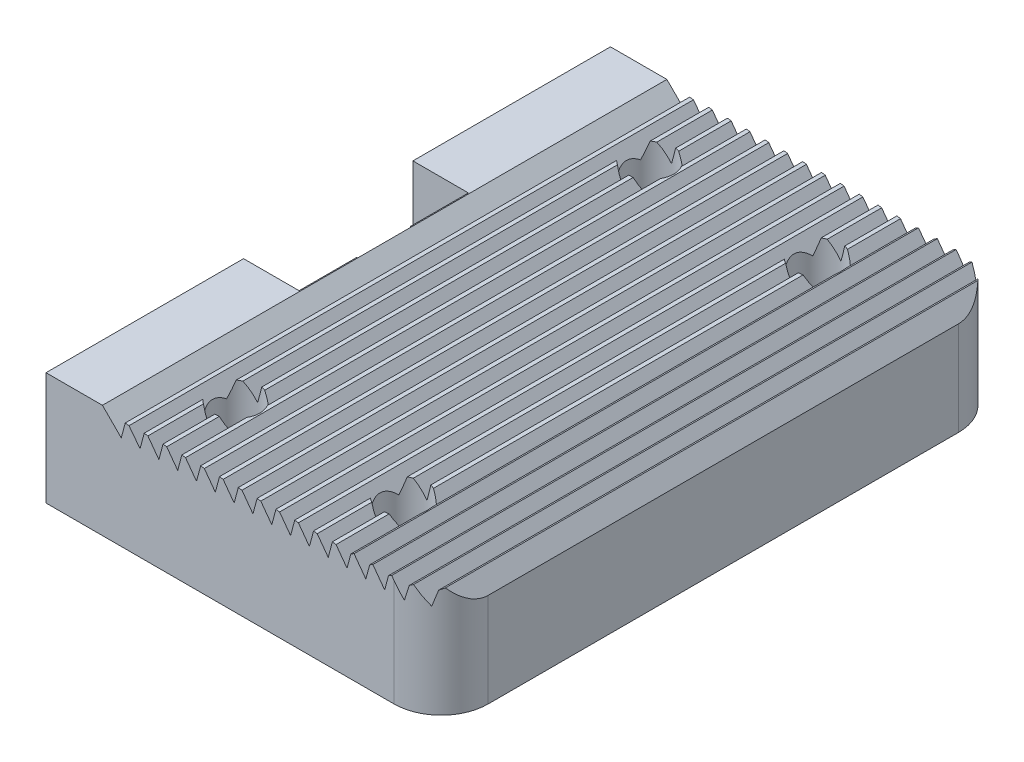
from build123d import *
from OCP.BRepFilletAPI import BRepFilletAPI_MakeChamfer

# Parameters (mm, degrees)
EXTRUDE_1_DEPTH     = 60
FILLET_1_R          = 5
CUT_EXTRUDE_1_DEPTH = 5.9
CHAMFER_1_SIZE      = 0.5
CHAMFER_1_SIZE2     = 0.355637567
CHAMFER_1_SIZE2_2   = 0.356604189
SKETCH_6_R          = 2.85
CUT_EXTRUDE_2_DEPTH = 0.1
SKETCH_7_R          = 2.5
CUT_EXTRUDE_3_DEPTH = 75.215901261


with BuildPart() as part:
    # 草图1 → 凸台-拉伸1 (new body)
    with BuildSketch(Plane.XY):
        Polygon((0, 0), (42, 0), (42, 10), (40.535898385, 12), (40, 10), (38.535898385, 12), (38, 10), (36.535898385, 12), (36, 10), (34.535898385, 12), (34, 10), (32.535898385, 12), (32, 10), (30.535898385, 12), (30, 10), (28.535898385, 12), (28, 10), (26.535898385, 12), (26, 10), (24.535898385, 12), (24, 10), (22.535898385, 12), (22, 10), (20.535898385, 12), (20, 10), (18.535898385, 12), (18, 10), (16.535898385, 12), (16, 10), (14.535898385, 12), (14, 10), (12.535898385, 12), (12, 10), (10.535898385, 12), (10, 10), (8.51763809, 11.931851653), (8, 10), (6, 12), (0, 12), align=None)
    extrude(amount=EXTRUDE_1_DEPTH)

    # 圆角1
    fillet_1_edges = [part.edges().sort_by_distance(p)[0] for p in [
        (42, 5, 0),
        (42, 5, 60),
    ]]
    fillet(fillet_1_edges, radius=FILLET_1_R)

    # 草图2 → 切除-拉伸1 (cut)
    with BuildSketch(Plane.ZY):
        with BuildLine():
            ThreePointArc((32.9, 12), (32.050609665, 9.949390335), (30, 9.1))
            Line((30, 9.1), (30, 0))
            Line((30, 0), (39, 0))
            Line((39, 0), (39, 12))
            Line((39, 12), (32.9, 12))
        make_face()
        with BuildLine():
            Line((30, 0), (30, 9.1))
            ThreePointArc((30, 9.1), (27.949390335, 9.949390335), (27.1, 12))
            Line((27.1, 12), (21, 12))
            Line((21, 12), (21, 0))
            Line((21, 0), (30, 0))
        make_face()
        with BuildLine():
            Line((32.9, 12), (30, 12))
            Line((30, 12), (30, 9.1))
            ThreePointArc((30, 9.1), (32.050609665, 9.949390335), (32.9, 12))
        make_face()
        with BuildLine():
            Line((30, 9.1), (30, 12))
            Line((30, 12), (27.1, 12))
            ThreePointArc((27.1, 12), (27.949390335, 9.949390335), (30, 9.1))
        make_face()
    extrude(amount=-CUT_EXTRUDE_1_DEPTH, mode=Mode.SUBTRACT)

    # 倒角1: one chamfer whose edges measure the first distance from different faces: ONE call of the kernel's chamfer builder (chamfer() names one face for all edges)
    chamfer_1_edges_1 = [part.edges().sort_by_distance(p)[0] for p in [
        (40.535898385, 12, 30),
    ]]
    chamfer_1_side_1 = [part.faces().sort_by_distance(p)[0] for p in [
        (40.267229154, 10.997312779, 30),
    ]]
    chamfer_1_edges_2 = [part.edges().sort_by_distance(p)[0] for p in [
        (38.535898385, 12, 30),
    ]]
    chamfer_1_side_2 = [part.faces().sort_by_distance(p)[0] for p in [
        (38.267738685, 10.999214377, 30),
    ]]
    chamfer_1_edges_3 = [part.edges().sort_by_distance(p)[0] for p in [
        (36.535898385, 12, 30),
    ]]
    chamfer_1_side_3 = [part.faces().sort_by_distance(p)[0] for p in [
        (36.267949192, 11, 30),
    ]]
    chamfer_1_edges_4 = [part.edges().sort_by_distance(p)[0] for p in [
        (34.535898385, 12, 30),
    ]]
    chamfer_1_side_4 = [part.faces().sort_by_distance(p)[0] for p in [
        (34.267949192, 11, 30),
    ]]
    chamfer_1_edges_5 = [part.edges().sort_by_distance(p)[0] for p in [
        (32.535898385, 12, 30),
    ]]
    chamfer_1_side_5 = [part.faces().sort_by_distance(p)[0] for p in [
        (32.267949192, 11, 30),
    ]]
    chamfer_1_edges_6 = [part.edges().sort_by_distance(p)[0] for p in [
        (30.535898385, 12, 30),
    ]]
    chamfer_1_side_6 = [part.faces().sort_by_distance(p)[0] for p in [
        (31.267949192, 11, 30),
    ]]
    chamfer_1_edges_7 = [part.edges().sort_by_distance(p)[0] for p in [
        (28.535898385, 12, 30),
    ]]
    chamfer_1_side_7 = [part.faces().sort_by_distance(p)[0] for p in [
        (29.267949192, 11, 30),
    ]]
    chamfer_1_edges_8 = [part.edges().sort_by_distance(p)[0] for p in [
        (26.535898385, 12, 30),
    ]]
    chamfer_1_side_8 = [part.faces().sort_by_distance(p)[0] for p in [
        (27.267949192, 11, 30),
    ]]
    chamfer_1_edges_9 = [part.edges().sort_by_distance(p)[0] for p in [
        (24.535898385, 12, 30),
    ]]
    chamfer_1_side_9 = [part.faces().sort_by_distance(p)[0] for p in [
        (25.267949192, 11, 30),
    ]]
    chamfer_1_edges_10 = [part.edges().sort_by_distance(p)[0] for p in [
        (22.535898385, 12, 30),
    ]]
    chamfer_1_side_10 = [part.faces().sort_by_distance(p)[0] for p in [
        (23.267949192, 11, 30),
    ]]
    chamfer_1_edges_11 = [part.edges().sort_by_distance(p)[0] for p in [
        (20.535898385, 12, 30),
    ]]
    chamfer_1_side_11 = [part.faces().sort_by_distance(p)[0] for p in [
        (21.267949192, 11, 30),
    ]]
    chamfer_1_edges_12 = [part.edges().sort_by_distance(p)[0] for p in [
        (18.535898385, 12, 30),
    ]]
    chamfer_1_side_12 = [part.faces().sort_by_distance(p)[0] for p in [
        (19.267949192, 11, 30),
    ]]
    chamfer_1_edges_13 = [part.edges().sort_by_distance(p)[0] for p in [
        (16.535898385, 12, 30),
    ]]
    chamfer_1_side_13 = [part.faces().sort_by_distance(p)[0] for p in [
        (17.267949192, 11, 30),
    ]]
    chamfer_1_edges_14 = [part.edges().sort_by_distance(p)[0] for p in [
        (14.535898385, 12, 30),
    ]]
    chamfer_1_side_14 = [part.faces().sort_by_distance(p)[0] for p in [
        (15.267949192, 11, 30),
    ]]
    chamfer_1_edges_15 = [part.edges().sort_by_distance(p)[0] for p in [
        (12.535898385, 12, 30),
    ]]
    chamfer_1_side_15 = [part.faces().sort_by_distance(p)[0] for p in [
        (13.267949192, 11, 30),
    ]]
    chamfer_1_edges_16 = [part.edges().sort_by_distance(p)[0] for p in [
        (10.535898385, 12, 30),
    ]]
    chamfer_1_side_16 = [part.faces().sort_by_distance(p)[0] for p in [
        (11.267949192, 11, 30),
    ]]
    chamfer_1_edges_17 = [part.edges().sort_by_distance(p)[0] for p in [
        (8.51763809, 11.931851653, 30),
    ]]
    chamfer_1_side_17 = [part.faces().sort_by_distance(p)[0] for p in [
        (9.258819045, 10.965925826, 30),
    ]]
    chamfer_1 = BRepFilletAPI_MakeChamfer(part.part.solid().wrapped)
    for e in chamfer_1_edges_1:
        chamfer_1.Add(CHAMFER_1_SIZE, CHAMFER_1_SIZE2, e.wrapped, chamfer_1_side_1[0].wrapped)  # the first distance lies on this face
    for e in chamfer_1_edges_2:
        chamfer_1.Add(CHAMFER_1_SIZE, CHAMFER_1_SIZE2, e.wrapped, chamfer_1_side_2[0].wrapped)  # the first distance lies on this face
    for e in chamfer_1_edges_3:
        chamfer_1.Add(CHAMFER_1_SIZE, CHAMFER_1_SIZE2, e.wrapped, chamfer_1_side_3[0].wrapped)  # the first distance lies on this face
    for e in chamfer_1_edges_4:
        chamfer_1.Add(CHAMFER_1_SIZE, CHAMFER_1_SIZE2, e.wrapped, chamfer_1_side_4[0].wrapped)  # the first distance lies on this face
    for e in chamfer_1_edges_5:
        chamfer_1.Add(CHAMFER_1_SIZE, CHAMFER_1_SIZE2, e.wrapped, chamfer_1_side_5[0].wrapped)  # the first distance lies on this face
    for e in chamfer_1_edges_6:
        chamfer_1.Add(CHAMFER_1_SIZE, CHAMFER_1_SIZE2, e.wrapped, chamfer_1_side_6[0].wrapped)  # the first distance lies on this face
    for e in chamfer_1_edges_7:
        chamfer_1.Add(CHAMFER_1_SIZE, CHAMFER_1_SIZE2, e.wrapped, chamfer_1_side_7[0].wrapped)  # the first distance lies on this face
    for e in chamfer_1_edges_8:
        chamfer_1.Add(CHAMFER_1_SIZE, CHAMFER_1_SIZE2, e.wrapped, chamfer_1_side_8[0].wrapped)  # the first distance lies on this face
    for e in chamfer_1_edges_9:
        chamfer_1.Add(CHAMFER_1_SIZE, CHAMFER_1_SIZE2, e.wrapped, chamfer_1_side_9[0].wrapped)  # the first distance lies on this face
    for e in chamfer_1_edges_10:
        chamfer_1.Add(CHAMFER_1_SIZE, CHAMFER_1_SIZE2, e.wrapped, chamfer_1_side_10[0].wrapped)  # the first distance lies on this face
    for e in chamfer_1_edges_11:
        chamfer_1.Add(CHAMFER_1_SIZE, CHAMFER_1_SIZE2, e.wrapped, chamfer_1_side_11[0].wrapped)  # the first distance lies on this face
    for e in chamfer_1_edges_12:
        chamfer_1.Add(CHAMFER_1_SIZE, CHAMFER_1_SIZE2, e.wrapped, chamfer_1_side_12[0].wrapped)  # the first distance lies on this face
    for e in chamfer_1_edges_13:
        chamfer_1.Add(CHAMFER_1_SIZE, CHAMFER_1_SIZE2, e.wrapped, chamfer_1_side_13[0].wrapped)  # the first distance lies on this face
    for e in chamfer_1_edges_14:
        chamfer_1.Add(CHAMFER_1_SIZE, CHAMFER_1_SIZE2, e.wrapped, chamfer_1_side_14[0].wrapped)  # the first distance lies on this face
    for e in chamfer_1_edges_15:
        chamfer_1.Add(CHAMFER_1_SIZE, CHAMFER_1_SIZE2, e.wrapped, chamfer_1_side_15[0].wrapped)  # the first distance lies on this face
    for e in chamfer_1_edges_16:
        chamfer_1.Add(CHAMFER_1_SIZE, CHAMFER_1_SIZE2, e.wrapped, chamfer_1_side_16[0].wrapped)  # the first distance lies on this face
    for e in chamfer_1_edges_17:
        chamfer_1.Add(CHAMFER_1_SIZE, CHAMFER_1_SIZE2_2, e.wrapped, chamfer_1_side_17[0].wrapped)  # the first distance lies on this face
    add(Compound.cast(chamfer_1.Shape()), mode=Mode.REPLACE)

    # 草图6 → 切除-拉伸2 (cut)
    with BuildSketch(Plane.ZY.offset(-5.9)):
        with Locations((30, 12)):
            Circle(SKETCH_6_R)
    extrude(amount=-CUT_EXTRUDE_2_DEPTH, mode=Mode.SUBTRACT)

    # 草图7 → 切除-拉伸3 (cut, through all)
    with BuildSketch(Plane.XZ):
        with Locations(Location((12.2, 52, 0), (0, 0, 270))):
            Circle(SKETCH_7_R)
        with Locations(Location((30, 52, 0), (0, 0, 90))):
            Circle(SKETCH_7_R)
        with Locations(Location((30, 8, 0), (0, 0, 270))):
            Circle(SKETCH_7_R)
        with Locations(Location((12.2, 8, 0), (0, 0, 265.411434264))):
            Circle(SKETCH_7_R)
    extrude(amount=-CUT_EXTRUDE_3_DEPTH, mode=Mode.SUBTRACT)


solid = part.part
